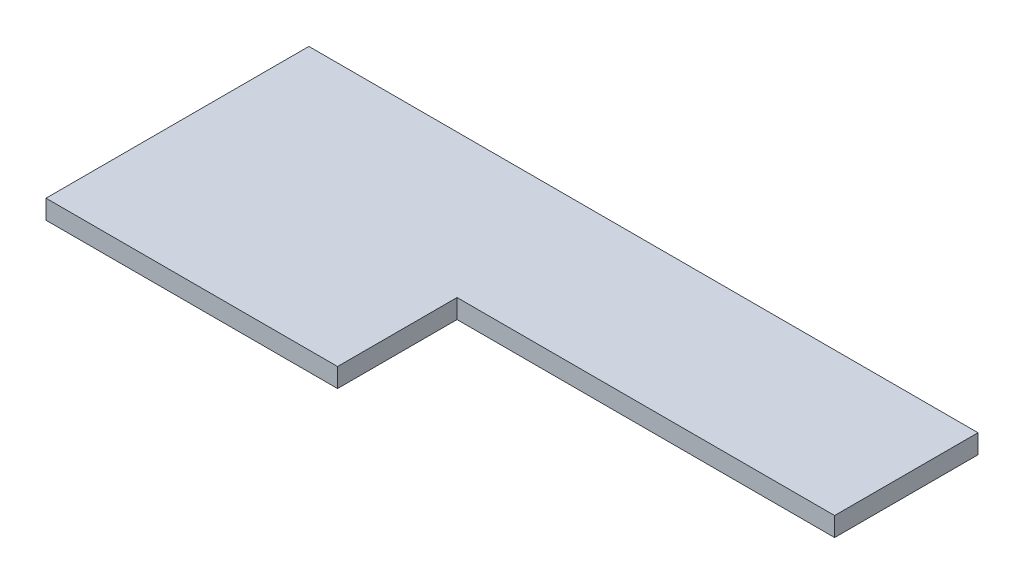
from build123d import *

# Parameters (mm, degrees)
BOSS_EXTRUDE1_DEPTH = 4


with BuildPart() as part:
    # Sketch2 → Boss-Extrude1 (new body)
    with BuildSketch(Plane(origin=(0, 0, 0), x_dir=(1, 0, 0), z_dir=(0, 1, 0))):
        Polygon((-55.919678715, 21.275100402), (84.080321285, 21.275100402), (84.080321285, -8.724899598), (5.080321285, -8.724899598), (5.080321285, -33.724899598), (-55.919678715, -33.724899598), align=None)
    extrude(amount=BOSS_EXTRUDE1_DEPTH)


solid = part.part
